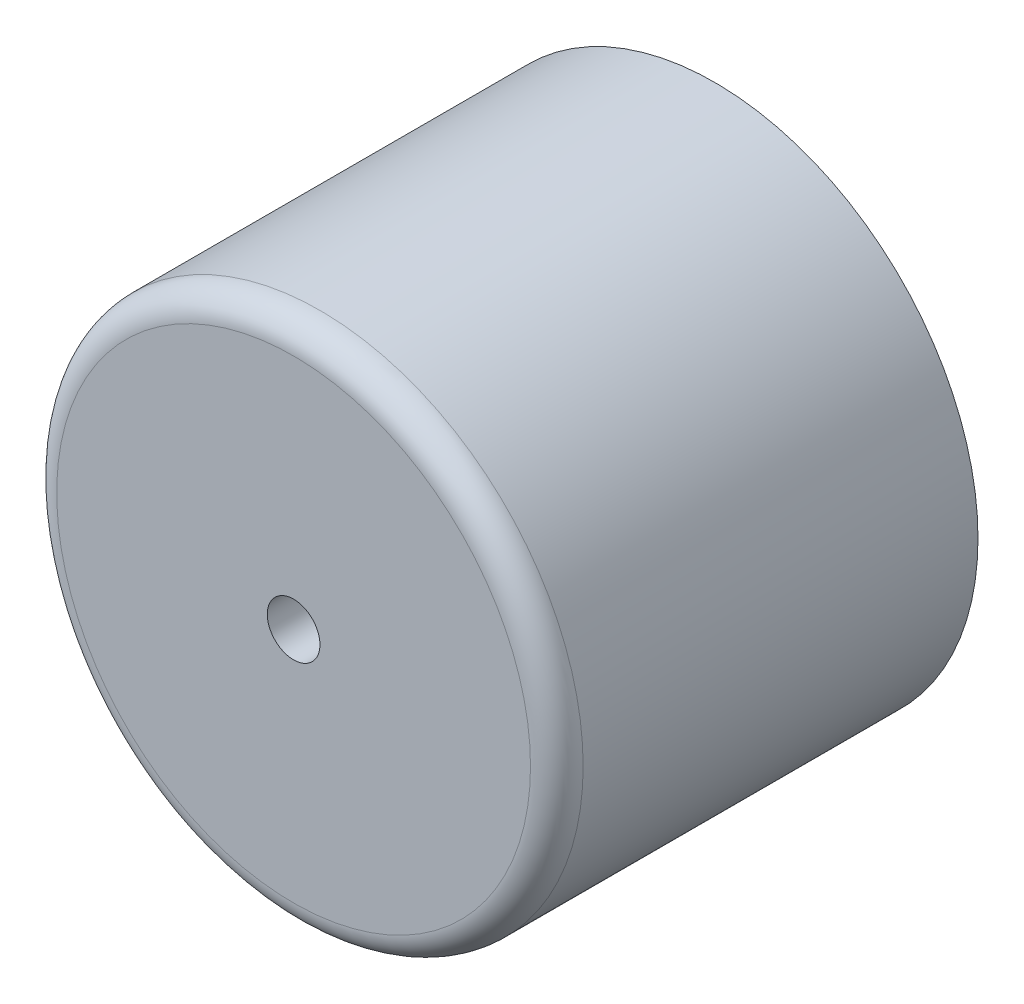
from build123d import *

# Parameters (mm, degrees)
SKETCH1_R           = 50
BOSS_EXTRUDE1_DEPTH = 80
FILLET1_R           = 5
SKETCH5_R           = 5
CUT_EXTRUDE2_DEPTH  = 80


with BuildPart() as part:
    # Sketch1 → Boss-Extrude1 (new body)
    with BuildSketch(Plane.XY):
        Circle(SKETCH1_R)
    extrude(amount=BOSS_EXTRUDE1_DEPTH)

    # Fillet1
    fillet1_edges = [part.edges().sort_by_distance(p)[0] for p in [
        (-50, 0, 80),
    ]]
    fillet(fillet1_edges, radius=FILLET1_R)

    # Sketch5 → Cut-Extrude2 (cut)
    with BuildSketch(Plane.XY.offset(80)):
        Circle(SKETCH5_R)
    extrude(amount=-CUT_EXTRUDE2_DEPTH, mode=Mode.SUBTRACT)


solid = part.part
